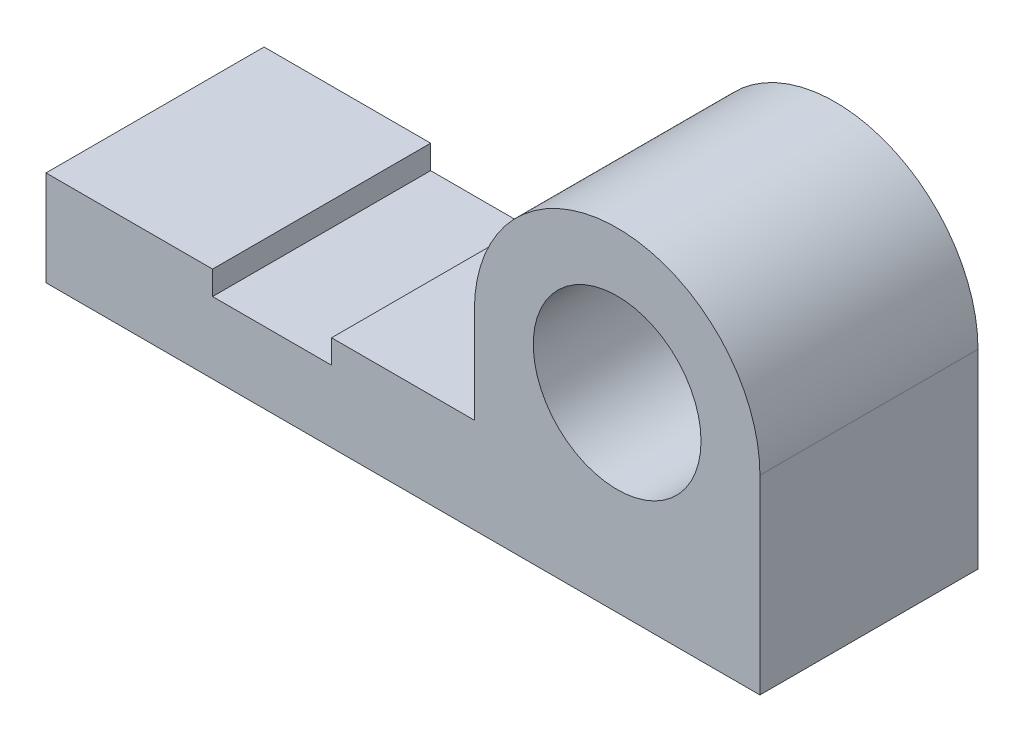
from build123d import *

# Parameters (mm, degrees)
SKETCH2_R           = 15
BOSS_EXTRUDE1_DEPTH = 39


with BuildPart() as part:
    # Sketch2 → Boss-Extrude1 (new body)
    with BuildSketch(Plane.XY):
        with BuildLine():
            Line((0, 0), (-127.68773646, 0))
            Line((-127.68773646, 0), (-127.68773646, 17.025031528))
            Line((-127.68773646, 17.025031528), (-97.893931286, 17.025031528))
            Line((-97.893931286, 17.025031528), (-97.893931286, 12.768773646))
            Line((-97.893931286, 12.768773646), (-76.612641876, 12.768773646))
            Line((-76.612641876, 12.768773646), (-76.612641876, 17.025031528))
            Line((-76.612641876, 17.025031528), (-51.075094584, 17.025031528))
            Line((-51.075094584, 17.025031528), (-51.075094584, 34.050063056))
            ThreePointArc((-51.075094584, 34.050063056), (-25.537547292, 59.587610348), (0, 34.050063056))
            Line((0, 34.050063056), (0, 0))
        make_face()
        with Locations((-25.537547292, 34.050063056)):
            Circle(SKETCH2_R, mode=Mode.SUBTRACT)
    extrude(amount=BOSS_EXTRUDE1_DEPTH)


solid = part.part
